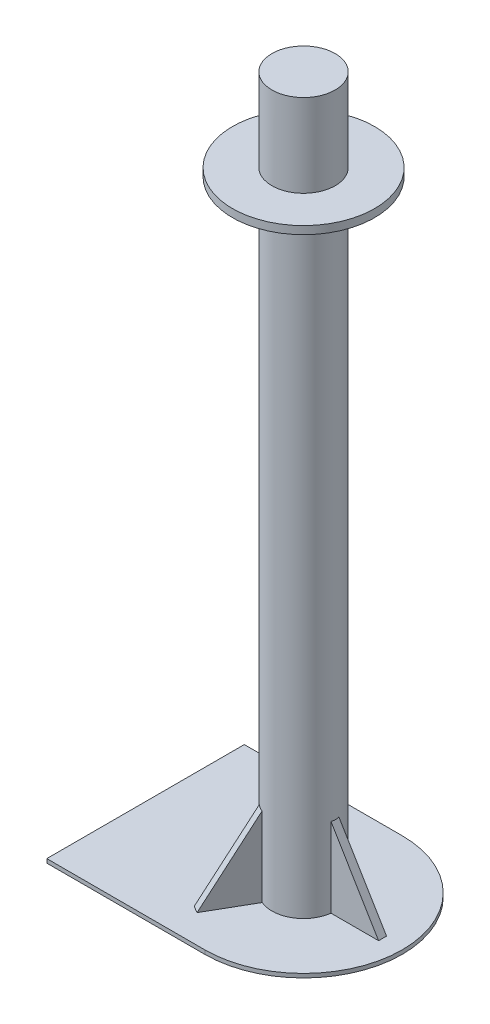
from build123d import *

# Parameters (mm, degrees)
EXTRUDE_1_DEPTH          = 5
SKETCH_2_R               = 40
EXTRUDE_2_DEPTH          = 900
SKETCH_3_R               = 90
EXTRUDE_3_DEPTH          = 10
EXTRUDE_6_DEPTH          = 5
PATTERN_CIRCULAR_1_COUNT = 3


with BuildPart() as part:
    # 草图1 → 凸台-拉伸1 (new body)
    with BuildSketch(Plane(origin=(0, 0, 0), x_dir=(1, 0, 0), z_dir=(0, 1, 0))):
        with BuildLine():
            Line((-119.91416309, -125), (-119.91416309, 125))
            Line((-119.91416309, 125), (80.08583691, 125))
            ThreePointArc((80.08583691, 125), (205.08583691, 0), (80.08583691, -125))
            Line((80.08583691, -125), (-119.91416309, -125))
        make_face()
    extrude(amount=EXTRUDE_1_DEPTH)

    # 草图2 → 凸台-拉伸2 (add)
    with BuildSketch(Plane(origin=(0, 5, 0), x_dir=(1, 0, 0), z_dir=(0, 1, 0))):
        with Locations(Location((80.08583691, 0, 0), (0, 0, 90))):
            Circle(SKETCH_2_R)
    extrude(amount=EXTRUDE_2_DEPTH)

    # 草图3 → 凸台-拉伸3 (add)
    with BuildSketch(Plane(origin=(0, 790, 0), x_dir=(-1, 0, 0), z_dir=(0, -1, 0))):
        with Locations(Location((-80.08583691, 0, 0), (0, 0, 90))):
            Circle(SKETCH_3_R)
    extrude(amount=-EXTRUDE_3_DEPTH)

    # 草图5 → 凸台-拉伸6 (add, symmetric)
    with BuildSketch(Plane.XY):
        Polygon((108.365396312, 5), (120.08583691, 5), (120.08583691, 105), (108.365396312, 124.534067663), align=None)
        Polygon((120.08583691, 5), (180.08583691, 5), (120.08583691, 105), align=None)
    extrude_6 = extrude(amount=EXTRUDE_6_DEPTH, both=True)

    # 阵列(圆周)1: 凸台-拉伸6 ×3 about axis
    pattern_circular_1_axis = Axis((80.08583691, 0, 0), (0, 1, 0))
    for i in range(1, PATTERN_CIRCULAR_1_COUNT):
        add(extrude_6.rotate(pattern_circular_1_axis, i * 360 / PATTERN_CIRCULAR_1_COUNT))


solid = part.part
